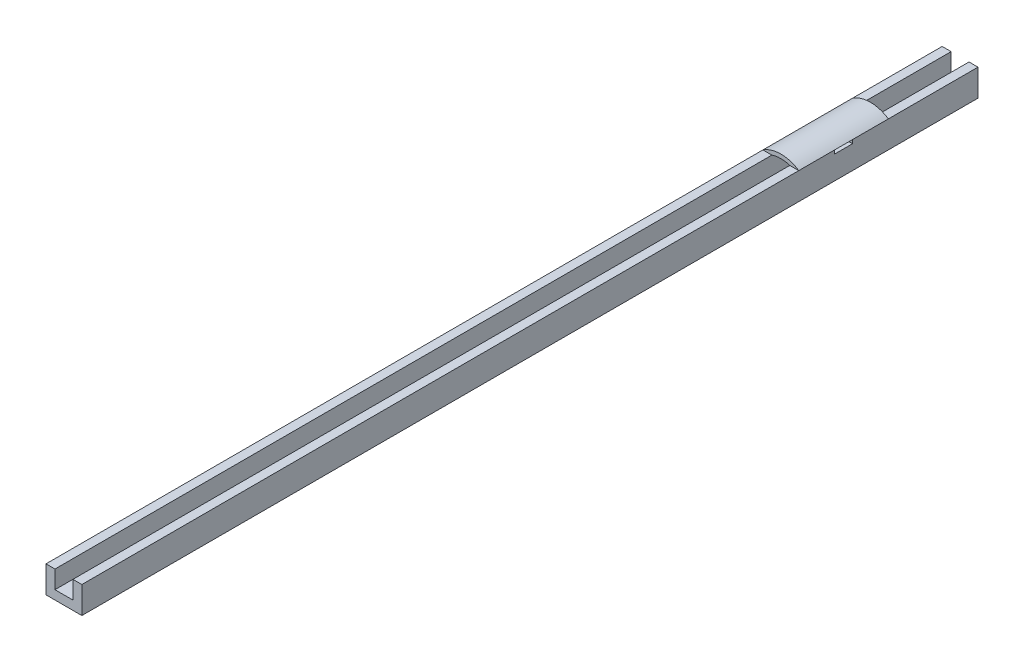
from build123d import *

# Parameters (mm, degrees)
EXTRUDE_1_DEPTH          = 1000
EXTRUDE_2_DEPTH          = 100
CUT_EXTRUDE_3_DEPTH      = 20
CUT_EXTRUDE_3_DEPTH_BACK = 842.888353643


with BuildPart() as part:
    # Эскиз2 → Бобышка-Вытянуть1 (new body)
    with BuildSketch(Plane.XY):
        Polygon((0, 0), (-10, 0), (-10, 20), (-20, 20), (-20, -10), (0, -10), (20, -10), (20, 20), (10, 20), (10, 0), align=None)
    extrude(amount=EXTRUDE_1_DEPTH)

    # Эскиз5 → Бобышка-Вытянуть2 (add)
    with BuildSketch(Plane.XY.offset(100)):
        with BuildLine():
            Line((-20, 20), (-10, 20))
            ThreePointArc((-10, 20), (0, 21.622776602), (10, 20))
            Line((10, 20), (20, 20))
            ThreePointArc((20, 20), (0, 26.055512755), (-20, 20))
        make_face()
    extrude(amount=EXTRUDE_2_DEPTH)

    # Sketch 5 2 → Вырез-Вытянуть3 (cut, two sides: drawn at the far end of the back side and taken through both)
    with BuildSketch(Plane(origin=(30, 16, 160), x_dir=(0, 0.1961161351381843, -0.9805806756909201), z_dir=(-1, 0, 0)).offset(-CUT_EXTRUDE_3_DEPTH_BACK)):
        Polygon((0, 0), (0.784464541, -3.922322703), (20.396078054, 0), (19.611613514, 3.922322703), align=None)
    extrude(amount=CUT_EXTRUDE_3_DEPTH + CUT_EXTRUDE_3_DEPTH_BACK, mode=Mode.SUBTRACT)


solid = part.part
